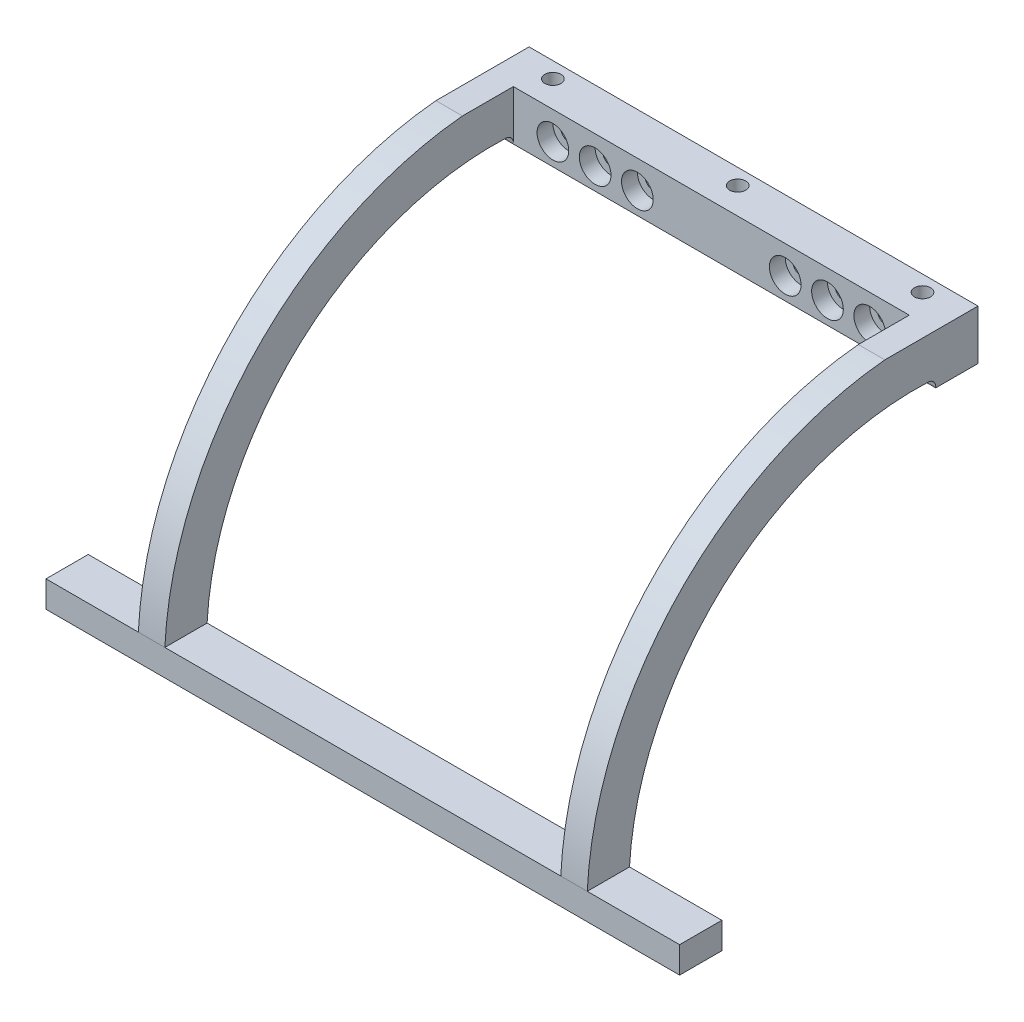
from build123d import *

# Parameters (mm, degrees)
SKETCH_1_W               = 120
SKETCH_1_H               = 8
EXTRUDE_1_DEPTH          = 5
SKETCH_2_W               = 5.019384612
SKETCH_2_H               = 8
PATTERN_LINEAR_2_COUNT   = 2
PATTERN_LINEAR_2_PITCH   = 80
EXTRUDE_3_DEPTH          = 6
EXTRUDE_3_DEPTH_BACK     = 2
SKETCH_5_W               = 85.019384612
SKETCH_5_H               = 9.428556335
SKETCH_6_R               = 1.52
CUT_EXTRUDE_1_DEPTH      = 18
PATTERN_LINEAR_3_COUNT   = 3
PATTERN_LINEAR_3_PITCH   = 8
MIRROR_1_COPY_1_SKETCH_R = 1.52
MIRROR_1_COPY_1_DEPTH    = 18
MIRROR_1_COPY_2_SKETCH_R = 1.52
MIRROR_1_COPY_2_DEPTH    = 18
SKETCH_7_R               = 1.52
CUT_EXTRUDE_2_DEPTH      = 15
SKETCH_8_W               = 136.689726825
SKETCH_8_H               = 40.838827277
CUT_EXTRUDE_3_DEPTH      = 8
SKETCH_10_R              = 3
CUT_EXTRUDE_5_DEPTH      = 3
FILLET_1_R               = 1.5
FILLET_2_R               = 1.5


with BuildPart() as part:
    # 草图1 → 凸台-拉伸1 (new body)
    with BuildSketch(Plane(origin=(0, 0, 0), x_dir=(1, 0, 0), z_dir=(0, 1, 0))):
        Rectangle(SKETCH_1_W, SKETCH_1_H)
    extrude(amount=EXTRUDE_1_DEPTH)

    # 扫描2: sweep along a curve in space
    with BuildLine() as sweep_2_path:
        ThreePointArc((-40, 5, 0), (-40, 46.186296303, -20.238339114), (-40, 60, -64))
    # 草图2 → 扫描2 (sweep)
    with BuildSketch(Plane(origin=(0, 5, 0), x_dir=(1, 0, 0), z_dir=(0, 1, 0))):
        with Locations((-40, 0)):
            Rectangle(SKETCH_2_W, SKETCH_2_H)
    sweep_2 = sweep(path=sweep_2_path.line)

    # 阵列(线性)2: 扫描2 ×2
    with Locations(*[(i * PATTERN_LINEAR_2_PITCH, 0, 0) for i in range(1, PATTERN_LINEAR_2_COUNT)]):
        add(sweep_2)

    # 草图5 → 凸台-拉伸3 (add, two sides: drawn at the far end of the back side and taken through both)
    with BuildSketch(Plane(origin=(0, 0, -64), x_dir=(-1, 0, 0), z_dir=(0, 0, -1)).offset(-EXTRUDE_3_DEPTH_BACK)):
        with Locations((0, 59.281524703)):
            Rectangle(SKETCH_5_W, SKETCH_5_H)
    extrude(amount=EXTRUDE_3_DEPTH + EXTRUDE_3_DEPTH_BACK)

    # 草图6 → 切除-拉伸1 (cut)
    with BuildSketch(Plane(origin=(0, 0, -70), x_dir=(-1, 0, 0), z_dir=(0, 0, -1))):
        with Locations((30, 58.693516137)):
            Circle(SKETCH_6_R)
    cut_extrude_1 = extrude(amount=-CUT_EXTRUDE_1_DEPTH, mode=Mode.SUBTRACT)

    # 阵列(线性)3: 切除-拉伸1 ×3
    with Locations(*[(i * PATTERN_LINEAR_3_PITCH, 0, 0) for i in range(1, PATTERN_LINEAR_3_COUNT)]):
        add(cut_extrude_1, mode=Mode.SUBTRACT)

    # 镜向1: 切除-拉伸1 across plane
    add(cut_extrude_1.mirror(Plane(origin=(0, 0, 0), x_dir=(0, 0, 1), z_dir=(1, 0, 0))), mode=Mode.SUBTRACT)

    # 镜向1 copy 1 sketch → 镜向1 copy 1 (cut)
    with BuildSketch(Plane(origin=(-8, 0, -70), x_dir=(1, 0, 0), z_dir=(0, 0, -1))):
        with Locations((30, -58.693516137)):
            Circle(MIRROR_1_COPY_1_SKETCH_R)
    extrude(amount=-MIRROR_1_COPY_1_DEPTH, mode=Mode.SUBTRACT)

    # 镜向1 copy 2 sketch → 镜向1 copy 2 (cut)
    with BuildSketch(Plane(origin=(-16, 0, -70), x_dir=(1, 0, 0), z_dir=(0, 0, -1))):
        with Locations((30, -58.693516137)):
            Circle(MIRROR_1_COPY_2_SKETCH_R)
    extrude(amount=-MIRROR_1_COPY_2_DEPTH, mode=Mode.SUBTRACT)

    # 草图7 → 切除-拉伸2 (cut)
    with BuildSketch(Plane(origin=(0, 54.567246535, 0), x_dir=(-1, 0, 0), z_dir=(0, -1, 0))):
        with Locations(Location((0, 67, 0), (0, 0, 90))):
            Circle(SKETCH_7_R)
        with Locations(Location((35, 67, 0), (0, 0, 90))):
            Circle(SKETCH_7_R)
        with Locations(Location((-35, 67, 0), (0, 0, 270))):
            Circle(SKETCH_7_R)
    extrude(amount=-CUT_EXTRUDE_2_DEPTH, mode=Mode.SUBTRACT)

    # 草图8 → 切除-拉伸3 (cut)
    with BuildSketch(Plane(origin=(0, 63.99580287, 0), x_dir=(1, 0, 0), z_dir=(0, 1, 0))):
        with Locations((2.188010226, 52.474472022)):
            Rectangle(SKETCH_8_W, SKETCH_8_H)
    extrude(amount=CUT_EXTRUDE_3_DEPTH, mode=Mode.SUBTRACT)

    # 草图10 → 切除-拉伸5 (cut)
    with BuildSketch(Plane.XY.offset(-62)):
        with Locations((30, 58.693516137)):
            Circle(SKETCH_10_R)
        with Locations((22, 58.693516137)):
            Circle(SKETCH_10_R)
        with Locations((14, 58.693516137)):
            Circle(SKETCH_10_R)
        with Locations(Location((-30, 58.693516137, 0), (0, 0, 180))):
            Circle(SKETCH_10_R)
        with Locations(Location((-22, 58.693516137, 0), (0, 0, 180))):
            Circle(SKETCH_10_R)
        with Locations(Location((-14, 58.693516137, 0), (0, 0, 180))):
            Circle(SKETCH_10_R)
    extrude(amount=-CUT_EXTRUDE_5_DEPTH, mode=Mode.SUBTRACT)

    # 圆角1
    fillet_1_edges = [part.edges().sort_by_distance(p)[0] for p in [
        (40, 56.159889336, -62),
    ]]
    fillet(fillet_1_edges, radius=FILLET_1_R)

    # 圆角2
    fillet_2_edges = [part.edges().sort_by_distance(p)[0] for p in [
        (-40, 56.159889336, -62),
    ]]
    fillet(fillet_2_edges, radius=FILLET_2_R)


solid = part.part
